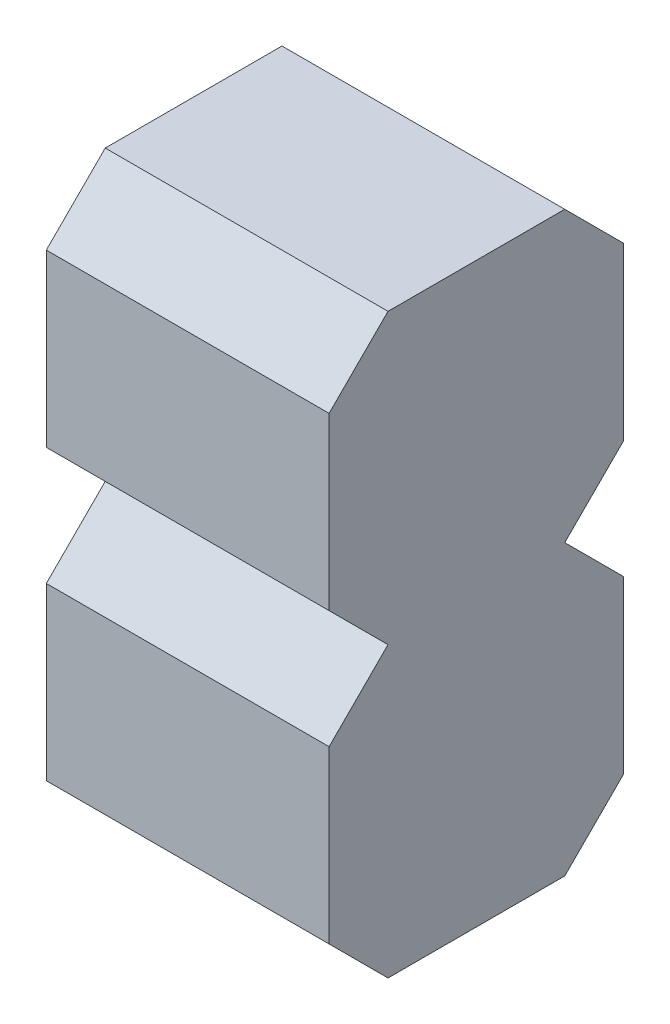
from build123d import *

# Parameters (mm, degrees)
SKICA1_W                 = 2.4
SKICA1_H                 = 4.9
P_IDAT_VYSUNUT_M1_DEPTH  = 2.5
ODEBRAT_VYSUNUT_M1_DEPTH = 2.5


with BuildPart() as part:
    # Skica1 → Přidat vysunutím1 (new body)
    with BuildSketch(Plane.XY):
        with Locations((-1.2, 2.45)):
            Rectangle(SKICA1_W, SKICA1_H)
    extrude(amount=P_IDAT_VYSUNUT_M1_DEPTH)

    # Skica3 → Odebrat vysunutím1 (cut)
    with BuildSketch(Plane(origin=(0, 0, 0), x_dir=(0, 0, -1), z_dir=(1, 0, 0))):
        Polygon((-2.5, 2.95), (-2, 2.45), (-2.5, 1.95), align=None)
        Polygon((0, 2.95), (-0.5, 2.45), (0, 1.95), align=None)
        Polygon((-2, 4.9), (-2.5, 4.4), (-2.5, 4.9), align=None)
        Polygon((-2.5, 0.5), (-2, 0), (-2.5, 0), align=None)
        Polygon((-0.5, 0), (0, 0.5), (0, 0), align=None)
        Polygon((0, 4.9), (0, 4.4), (-0.5, 4.9), align=None)
    extrude(amount=-ODEBRAT_VYSUNUT_M1_DEPTH, mode=Mode.SUBTRACT)


solid = part.part
